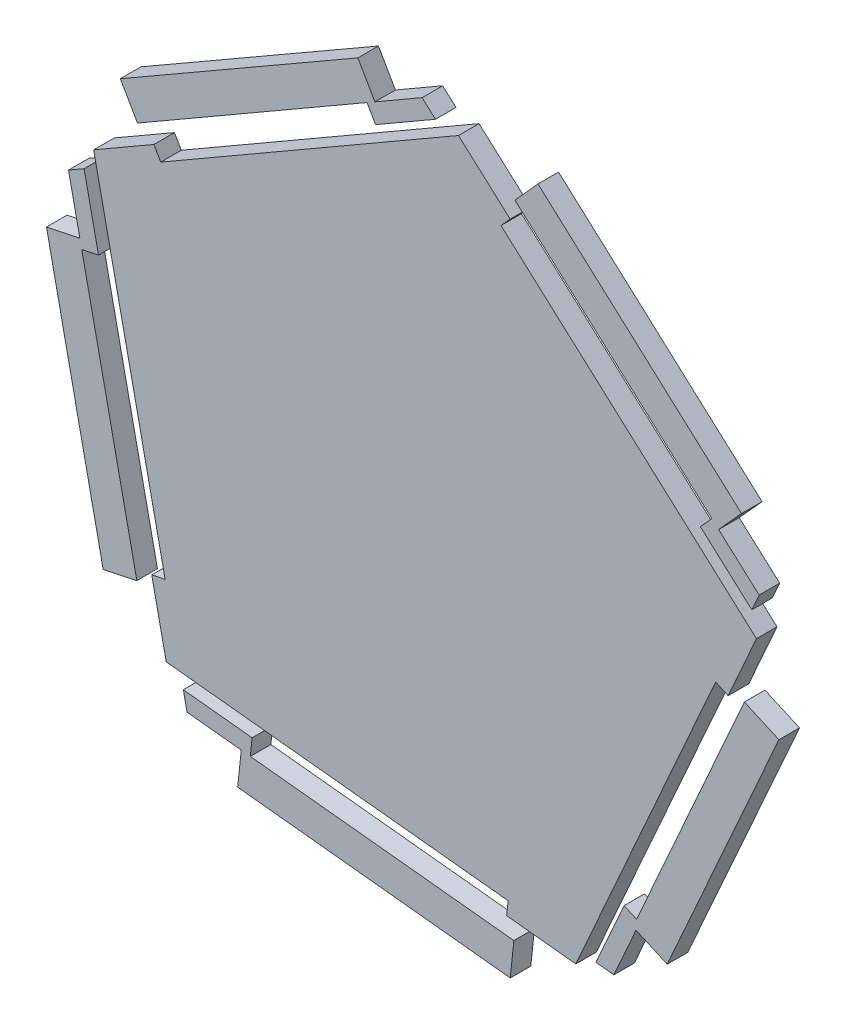
from build123d import *

# Parameters (mm, degrees)
BOSS_EXTRUDE1_DEPTH = 3
CUT_EXTRUDE3_DEPTH  = 10


with BuildPart() as part:
    # Sketch1 → Boss-Extrude1 (new body)
    with BuildSketch(Plane.XY):
        Polygon((-41.404007678, -45.884292091), (30.844012981, -53.556577334), (60.46665605, 12.784506978), (6.526435644, 61.457837175), (-56.433096997, 25.198525272), align=None)
    extrude(amount=BOSS_EXTRUDE1_DEPTH)

    # Sketch4 → Cut-Extrude3 (cut)
    with BuildSketch(Plane.XY.offset(3)):
        Polygon((48.765589151, 0.121903102), (49.22236188, -0.08146522), (53.809748587, -2.123901372), (60.46665605, 12.784506978), (48.345014677, 23.722553737), (45.005827669, 20.030043583), (50.917437936, 14.707205791), (49.84384433, 12.30979199), (42.347693446, 19.059356563), (43.685954659, 20.545646214), (44.020519963, 20.917218627), (16.273265348, 45.900958899), (15.288024352, 46.788073876), (18.648077016, 50.519790415), (6.526435644, 61.457837175), (-7.622058186, 53.309513494), (-5.142137876, 48.99270954), (1.746969728, 52.97013767), (1.75942092, 52.958877889), (3.695287077, 51.20824787), (-5.040368308, 46.164714882), (-6.290368308, 48.329778391), (-39.77384321, 28.998085143), (-42.284603166, 33.346848953), (-56.433096997, 25.198525272), (-53.0557057, 9.224537526), (-48.18384365, 10.249116114), (-49.837751265, 18.030139678), (-49.823194949, 18.038502), (-47.560031319, 19.338645698), (-45.462812376, 9.472006315), (-47.419107578, 9.056182934), (-47.908181378, 8.952227088), (-40.145254927, -27.569470429), (-39.869611319, -28.866271649), (-44.781398973, -29.910304344), (-41.404007678, -45.884292091), (-25.168171234, -47.608435772), (-24.637115209, -42.658407427), (-32.548393933, -41.826898527), (-32.551848825, -41.810470547), (-33.089002938, -39.256307532), (-23.057194965, -40.310693037), (-23.266251892, -42.299736828), (-23.318516123, -42.796997776), (13.814558486, -46.699841186), (15.133068296, -46.838422151), (14.608176536, -51.832433652), (30.844012981, -53.556577334), (37.500920443, -38.648168984), (32.957269066, -36.61346181), (29.721737535, -43.880584612), (27.109902849, -43.600378026), (31.212682203, -34.385384722), (33.039773118, -35.198858009), align=None)
        Polygon((24.175040114, -45.275000985), (14.081237376, -44.214099567), (14.294580487, -42.225506273), (-35.588586477, -36.982574156), (-37.698765855, -27.054960721), (-35.741574597, -26.643352955), (-46.169996168, 22.418513165), (-37.380356008, 27.493214278), (-36.3840884, 25.759008573), (7.053959585, 50.83797727), (14.59643533, 44.046701604), (13.254971316, 42.563295769), (50.529582947, 9.001084707), (46.401449157, -0.270855594), (44.576111193, 0.546554886), align=None, mode=Mode.SUBTRACT)
    extrude(amount=-CUT_EXTRUDE3_DEPTH, mode=Mode.SUBTRACT)


with BuildPart() as cut_extrude3_piece_1:
    # of the separate pieces the step leaves, piece 1, a body of its own (cut_extrude3_pieces)
    add(part.part.solids().sort_by_distance((13.254971316, 42.563295769, 0))[0])


with BuildPart() as cut_extrude3_piece_2:
    # of the separate pieces the step leaves, piece 2, a body of its own (cut_extrude3_pieces)
    add(part.part.solids().sort_by_distance((37.500920444, -38.648168984, 0))[0])


with BuildPart() as cut_extrude3_piece_3:
    # of the separate pieces the step leaves, piece 3, a body of its own (cut_extrude3_pieces)
    add(part.part.solids().sort_by_distance((-25.168171234, -47.608435773, 0))[0])


with BuildPart() as cut_extrude3_piece_4:
    # of the separate pieces the step leaves, piece 4, a body of its own (cut_extrude3_pieces)
    add(part.part.solids().sort_by_distance((-53.055705701, 9.224537526, 0))[0])


with BuildPart() as cut_extrude3_piece_5:
    # of the separate pieces the step leaves, piece 5, a body of its own (cut_extrude3_pieces)
    add(part.part.solids().sort_by_distance((-7.622058186, 53.309513494, 0))[0])


with BuildPart() as cut_extrude3_piece_6:
    # of the separate pieces the step leaves, piece 6, a body of its own (cut_extrude3_pieces)
    add(part.part.solids().sort_by_distance((48.345014677, 23.722553737, 0))[0])


solid = Compound([cut_extrude3_piece_1.part, cut_extrude3_piece_2.part, cut_extrude3_piece_3.part, cut_extrude3_piece_4.part, cut_extrude3_piece_5.part, cut_extrude3_piece_6.part])
